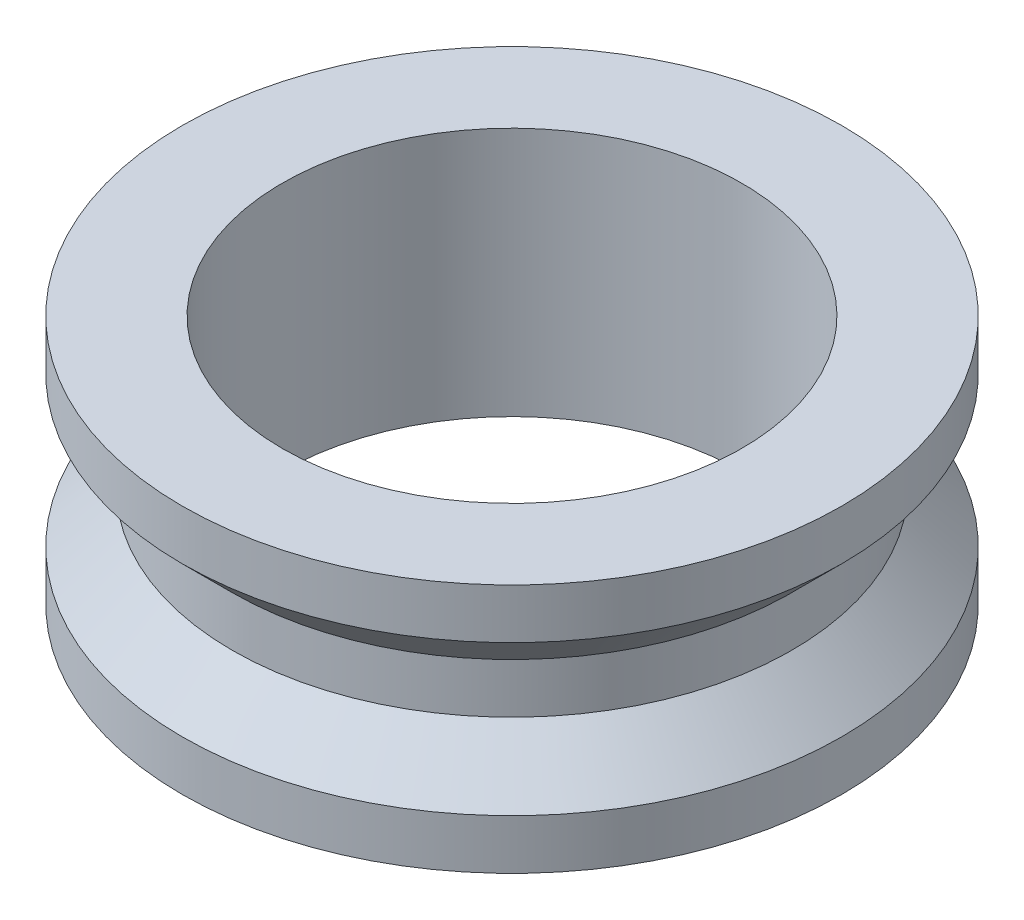
from build123d import *


with BuildPart() as part:
    # 草图2 → 旋转1 (revolve)
    with BuildSketch(Plane.XY, mode=Mode.PRIVATE) as revolve_1_sk:
        Polygon((-4.6, 0), (-6.6, 0), (-6.6, 1), (-5.6, 2), (-5.6, 3), (-6.6, 4), (-6.6, 5), (-4.6, 5), align=None)
    revolve(revolve_1_sk.sketch.rotate(Axis((0, 5.215955033, 0), (0, -1, 0)), 270), axis=Axis((0, 5.215955033, 0), (0, -1, 0)))


solid = part.part
